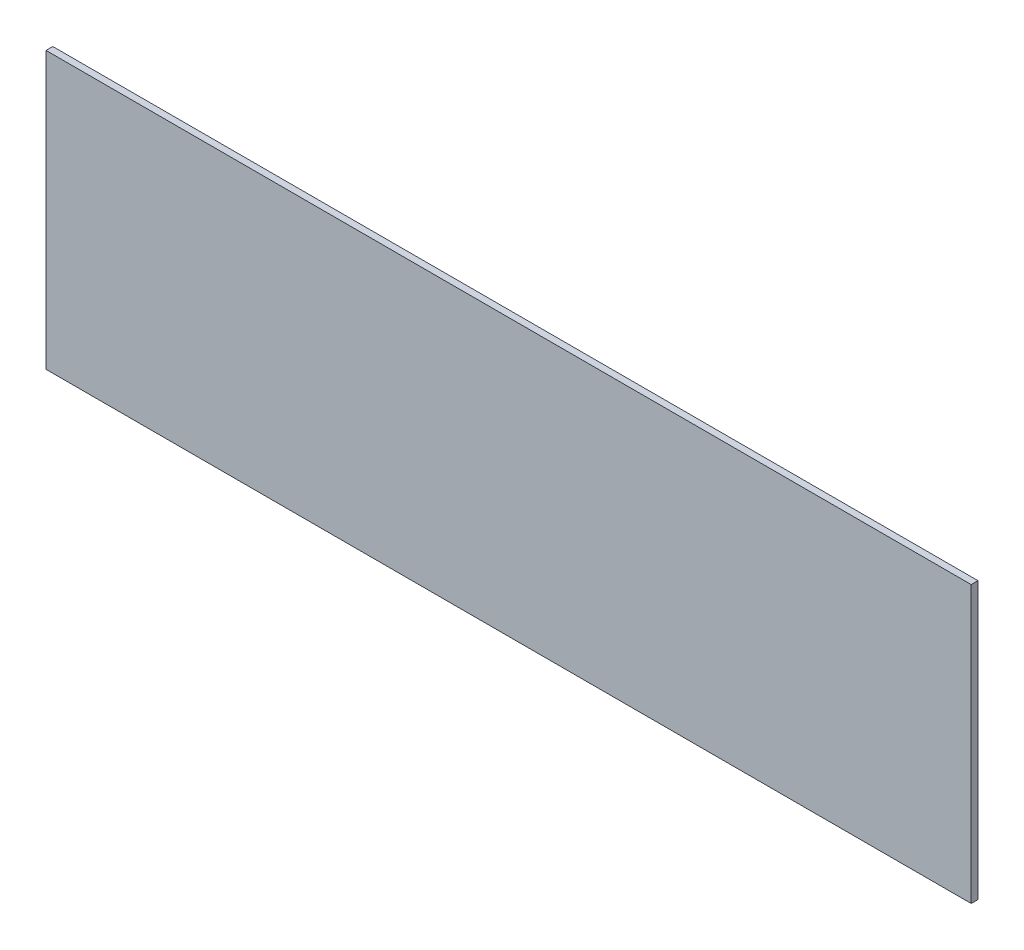
from build123d import *

# Parameters (mm, degrees)
ESQUISSE1_W        = 546
ESQUISSE1_H        = 163
BOSS_EXTRU_1_DEPTH = 4


with BuildPart() as part:
    # Esquisse1 → Boss.-Extru.1 (new body)
    with BuildSketch(Plane.XY):
        Rectangle(ESQUISSE1_W, ESQUISSE1_H)
    extrude(amount=BOSS_EXTRU_1_DEPTH)


solid = part.part
